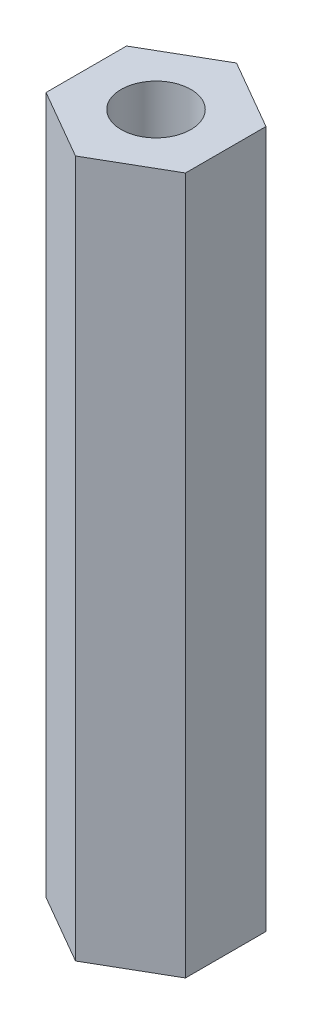
from build123d import *

# Parameters (mm, degrees)
EXTRUDE_1_DEPTH     = 30
SKETCH_2_R          = 1.5
CUT_EXTRUDE_1_DEPTH = 50


with BuildPart() as part:
    # 스케치1 → 보스-돌출1 (new body)
    with BuildSketch(Plane(origin=(0, 0, 0), x_dir=(1, 0, 0), z_dir=(0, 1, 0))):
        Polygon((0, 3.464101615), (-3, 1.732050808), (-3, -1.732050808), (0, -3.464101615), (3, -1.732050808), (3, 1.732050808), align=None)
    extrude(amount=EXTRUDE_1_DEPTH)

    # 스케치2 → 컷-돌출1 (cut)
    with BuildSketch(Plane(origin=(0, 30, 0), x_dir=(1, 0, 0), z_dir=(0, 1, 0))):
        with Locations(Location((0, 0, 0), (0, 0, 270))):
            Circle(SKETCH_2_R)
    extrude(amount=-CUT_EXTRUDE_1_DEPTH, mode=Mode.SUBTRACT)


solid = part.part
